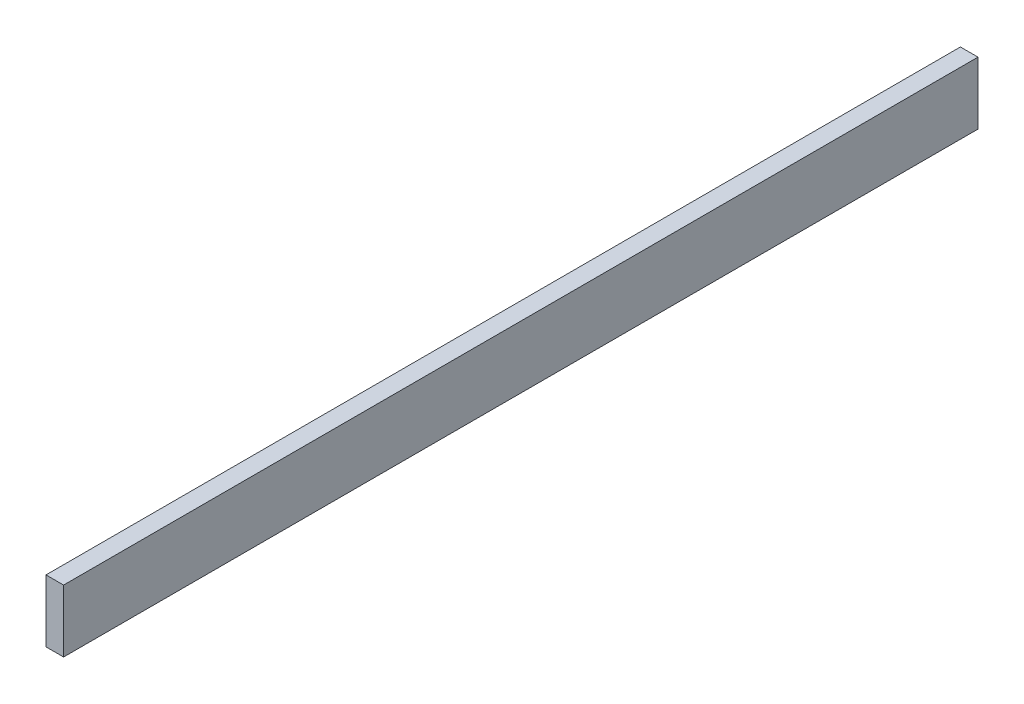
from build123d import *

# Parameters (mm, degrees)
SKETCH1_W                            = 12.7
SKETCH1_H                            = 45
CEK_ICECEK_RAY_IC_PROFIL_SOL_1_DEPTH = 660


with BuildPart() as part:
    # Sketch1 → CEK_icecek_ray_ic_profil_sol_1 (new body)
    with BuildSketch(Plane.XY):
        with Locations((6.35, 36.5)):
            Rectangle(SKETCH1_W, SKETCH1_H)
    extrude(amount=-CEK_ICECEK_RAY_IC_PROFIL_SOL_1_DEPTH)


solid = part.part
